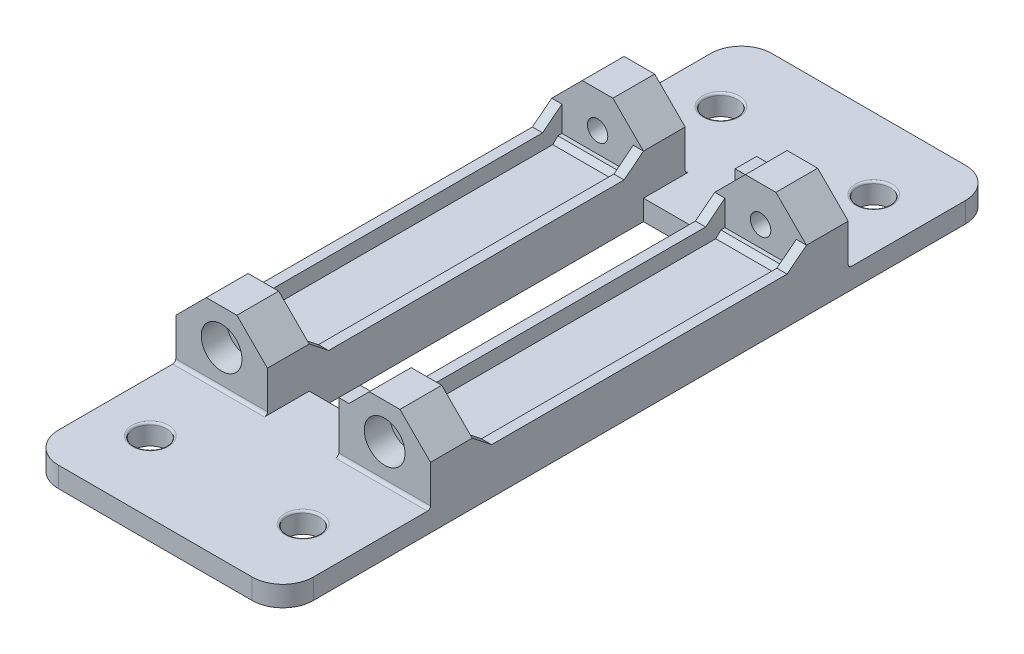
from build123d import *

# Parameters (mm, degrees)
SKETCH1_R                = 1.5
SKETCH1_R_2              = 1
SKETCH1_W                = 6
SKETCH1_H                = 10
EXTRUDE1_DEPTH           = 3
EXTRUDE2_DEPTH           = 4
EXTRUDE3_DEPTH           = 4
SKETCH7_W                = 1
SKETCH7_H                = 38
SKETCH7_W_2              = 6
SKETCH7_H_2              = 10
EXTRUDE4_DEPTH           = 4.5
EXTRUDE5_DEPTH           = 6
SKETCH9_R                = 5.5
SKETCH9_R_2              = 1.5
EXTRUDE10_DEPTH          = 3.5
EXTRUDE11_DEPTH          = 6
EXTRUDE12_DEPTH          = 4
CUT_EXTRUDE1_DEPTH       = 4
CUT_EXTRUDE2_DEPTH       = 4
SKETCH16_R               = 1
EXTRUDE13_DEPTH          = 2.6
CUT_EXTRUDE4_DEPTH       = 3
CUT_EXTRUDE5_DEPTH       = 32.906112267
CUT_EXTRUDE6_DEPTH       = 2
EXTRUDE14_DEPTH          = 25
EXTRUDE15_DEPTH          = 1
EXTRUDE17_DEPTH          = 1
EXTRUDE18_DEPTH          = 1
EXTRUDE19_DEPTH          = 1
CUT_EXTRUDE7_DEPTH       = 43.121847063
SKETCH26_R               = 2
CUT_EXTRUDE8_DEPTH       = 1
SKETCH27_R               = 4
CUT_EXTRUDE9_DEPTH       = 1.5
SKETCH28_R               = 4
CUT_EXTRUDE10_DEPTH      = 1
CUT_EXTRUDE11_DEPTH      = 1.5
FILLET4_R                = 0.25
CUT_EXTRUDE12_DEPTH      = 1.5
SKETCH31_W               = 16.002833782
SKETCH31_H               = 38
CUT_EXTRUDE13_DEPTH      = 32.906112267
CUT_EXTRUDE14_DEPTH      = 14.5
CUT_EXTRUDE14_DEPTH_BACK = 14.5
EXTRUDE20_DEPTH          = 15
EXTRUDE20_DEPTH_BACK     = 15
EXTRUDE21_DEPTH          = 1
CUT_EXTRUDE15_DEPTH      = 0.5
SKETCH36_R               = 1
CUT_EXTRUDE16_DEPTH      = 10.5
SKETCH37_W               = 7
SKETCH37_H               = 2.6
CUT_EXTRUDE18_DEPTH      = 25.459149617
SKETCH38_W               = 25
SKETCH38_H               = 70
BOSS_EXTRUDE1_DEPTH      = 2
FILLET5_R                = 3
SKETCH40_W               = 7
SKETCH40_H               = 22
CUT_EXTRUDE20_DEPTH      = 1
SKETCH41_W               = 7
SKETCH41_H               = 20
BOSS_EXTRUDE2_DEPTH      = 1
SKETCH44_W               = 7
SKETCH44_H               = 10.4
CUT_EXTRUDE22_DEPTH      = 38.5
SKETCH45_W               = 7
SKETCH45_H               = 12
CUT_EXTRUDE23_DEPTH      = 38.436613095
SKETCH46_W               = 7
SKETCH46_H               = 0.4
BOSS_EXTRUDE3_DEPTH      = 0.5
SKETCH47_R               = 2
BOSS_EXTRUDE4_DEPTH      = 1.5
FILLET6_R                = 0.3
SKETCH49_R               = 1.6
CUT_EXTRUDE24_DEPTH      = 38.818646195
FILLET7_R                = 0.2


with BuildPart() as part:
    # Sketch1 → Extrude1 (new body)
    with BuildSketch(Plane(origin=(0, 0, 0), x_dir=(1, 0, 0), z_dir=(0, 1, 0))):
        with BuildLine():
            Line((-12.5, -19), (-12.5, -12.75))
            ThreePointArc((-12.5, -12.75), (-13.085786438, -11.335786438), (-14.5, -10.75))
            Line((-14.5, -10.75), (-19, -10.75))
            ThreePointArc((-19, -10.75), (-22.535533906, -9.285533906), (-24, -5.75))
            Line((-24, -5.75), (-24, 5.75))
            ThreePointArc((-24, 5.75), (-22.535533906, 9.285533906), (-19, 10.75))
            Line((-19, 10.75), (-14.5, 10.75))
            ThreePointArc((-14.5, 10.75), (-13.085786438, 11.335786438), (-12.5, 12.75))
            Line((-12.5, 12.75), (-12.5, 19))
            Line((-12.5, 19), (12.5, 19))
            Line((12.5, 19), (12.5, -19))
            Line((12.5, -19), (-12.5, -19))
        make_face()
        with Locations(Location((-14.5, 0, 0), (0, 0, 270))):
            Circle(SKETCH1_R, mode=Mode.SUBTRACT)
        with Locations(Location((0, 8, 0), (0, 0, 270))):
            Circle(SKETCH1_R_2, mode=Mode.SUBTRACT)
        with Locations(Location((8, 0, 0), (0, 0, 270))):
            Circle(SKETCH1_R_2, mode=Mode.SUBTRACT)
        with Locations(Location((0, -8, 0), (0, 0, 270))):
            Circle(SKETCH1_R_2, mode=Mode.SUBTRACT)
        with Locations(Location((-8, 0, 0), (0, 0, 270))):
            Circle(SKETCH1_R_2, mode=Mode.SUBTRACT)
        with Locations(Location((-20.156854249, 5.656854249, 0), (0, 0, 270))):
            Circle(SKETCH1_R_2, mode=Mode.SUBTRACT)
        with Locations(Location((-20.156854249, -5.656854249, 0), (0, 0, 270))):
            Circle(SKETCH1_R_2, mode=Mode.SUBTRACT)
        with Locations(Location((-8.843145751, -5.656854249, 0), (0, 0, 270))):
            Circle(SKETCH1_R_2, mode=Mode.SUBTRACT)
        with Locations(Location((-8.843145751, 5.656854249, 0), (0, 0, 270))):
            Circle(SKETCH1_R_2, mode=Mode.SUBTRACT)
        with Locations(Location((8, 8, 0), (0, 0, 270))):
            Circle(SKETCH1_R_2, mode=Mode.SUBTRACT)
        with Locations(Location((8, -8, 0), (0, 0, 270))):
            Circle(SKETCH1_R_2, mode=Mode.SUBTRACT)
        Rectangle(SKETCH1_W, SKETCH1_H, mode=Mode.SUBTRACT)
    extrude(amount=EXTRUDE1_DEPTH)

    # Sketch2 → Extrude2 (add)
    # profile 1 of 4: a face of its own
    with BuildSketch(Plane(origin=(0, 0, 0), x_dir=(1, 0, 0), z_dir=(0, 1, 0))):
        Polygon((-19.260278777, -2.310789035), (-16.810789035, -4.760278777), (-17.707364507, -8.106343992), (-21.053429722, -9.002919464), (-23.502919464, -6.553429722), (-22.606343992, -3.207364507), align=None)
        Polygon((-19.559663372, -3.426127712), (-17.926258803, -5.058709362), (-18.523413702, -7.289570039), (-20.75397317, -7.887849066), (-22.387377739, -6.255267415), (-21.79022284, -4.024406738), align=None, mode=Mode.SUBTRACT)
    # profile 2 of 4: a face of its own
    with BuildSketch(Plane(origin=(0, 0, 0), x_dir=(1, 0, 0), z_dir=(0, 1, 0))):
        Polygon((-6.393656008, 3.207364507), (-9.739721223, 2.310789035), (-12.189210965, 4.760278777), (-11.292635493, 8.106343992), (-7.946570278, 9.002919464), (-5.497080536, 6.553429722), align=None)
        Polygon((-7.210429961, 4.023413702), (-9.441290638, 3.426258803), (-11.073872288, 5.059663372), (-10.475593262, 7.29022284), (-8.244732585, 7.887377739), (-6.612150934, 6.25397317), align=None, mode=Mode.SUBTRACT)
    # profile 3 of 4: a face of its own
    with BuildSketch(Plane(origin=(0, 0, 0), x_dir=(1, 0, 0), z_dir=(0, 1, 0))):
        Polygon((-16.810789035, 4.760278777), (-19.260278777, 2.310789035), (-22.606343992, 3.207364507), (-23.502919464, 6.553429722), (-21.053429722, 9.002919464), (-17.707364507, 8.106343992), align=None)
        Polygon((-17.926127712, 5.059663372), (-19.558709362, 3.426258803), (-21.789570039, 4.023413702), (-22.387849066, 6.25397317), (-20.755267415, 7.887377739), (-18.524406738, 7.29022284), align=None, mode=Mode.SUBTRACT)
    # profile 4 of 4: a face of its own
    with BuildSketch(Plane(origin=(0, 0, 0), x_dir=(1, 0, 0), z_dir=(0, 1, 0))):
        Polygon((-12.189210965, -4.760278777), (-9.739721223, -2.310789035), (-6.393656008, -3.207364507), (-5.497080536, -6.553429722), (-7.946570278, -9.002919464), (-11.292635493, -8.106343992), align=None)
        Polygon((-11.073872288, -5.059663372), (-9.441290638, -3.426258803), (-7.210429961, -4.023413702), (-6.612150934, -6.25397317), (-8.244732585, -7.887377739), (-10.475593262, -7.29022284), align=None, mode=Mode.SUBTRACT)
    extrude(amount=EXTRUDE2_DEPTH)

    # Sketch5 → Extrude3 (add)
    # profile 1 of 6: a face of its own
    with BuildSketch(Plane(origin=(0, 0, 0), x_dir=(1, 0, 0), z_dir=(0, 1, 0))):
        Polygon((-3.464101615, -8), (-1.732050808, -11), (1.732050808, -11), (3.464101615, -8), (1.732050808, -5), (-1.732050808, -5), align=None)
        Polygon((-2.309401077, -8), (-1.154700538, -10), (1.154700538, -10), (2.309401077, -8), (1.154700538, -6), (-1.154700538, -6), align=None, mode=Mode.SUBTRACT)
    # profile 2 of 6: a face of its own
    with BuildSketch(Plane(origin=(0, 0, 0), x_dir=(1, 0, 0), z_dir=(0, 1, 0))):
        Polygon((-1.732050808, 11), (1.732050808, 11), (3.464101615, 8), (1.732050808, 5), (-1.732050808, 5), (-3.464101615, 8), align=None)
        Polygon((-1.154700538, 10), (1.154700538, 10), (2.309401077, 8), (1.154700538, 6), (-1.154700538, 6), (-2.309401077, 8), align=None, mode=Mode.SUBTRACT)
    # profile 3 of 6: a face of its own
    with BuildSketch(Plane(origin=(0, 0, 0), x_dir=(1, 0, 0), z_dir=(0, 1, 0))):
        Polygon((11.464101615, 8), (9.732050808, 11), (6.267949192, 11), (4.535898385, 8), (6.267949192, 5), (9.732050808, 5), align=None)
        Polygon((10.309401077, 8), (9.154700538, 10), (6.845299462, 10), (5.690598923, 8), (6.845299462, 6), (9.154700538, 6), align=None, mode=Mode.SUBTRACT)
    # profile 4 of 6: a face of its own
    with BuildSketch(Plane(origin=(0, 0, 0), x_dir=(1, 0, 0), z_dir=(0, 1, 0))):
        Polygon((9.732050808, -11), (6.267949192, -11), (4.535898385, -8), (6.267949192, -5), (9.732050808, -5), (11.464101615, -8), align=None)
        Polygon((9.154700538, -10), (6.845299462, -10), (5.690598923, -8), (6.845299462, -6), (9.154700538, -6), (10.309401077, -8), align=None, mode=Mode.SUBTRACT)
    # profile 5 of 6: a face of its own
    with BuildSketch(Plane(origin=(0, 0, 0), x_dir=(1, 0, 0), z_dir=(0, 1, 0))):
        Polygon((9.732050808, -3), (6.267949192, -3), (4.535898385, 0), (6.267949192, 3), (9.732050808, 3), (11.464101615, 0), align=None)
        Polygon((9.154700538, -2), (6.845299462, -2), (5.690598923, 0), (6.845299462, 2), (9.154700538, 2), (10.309401077, 0), align=None, mode=Mode.SUBTRACT)
    # profile 6 of 6: a face of its own
    with BuildSketch(Plane(origin=(0, 0, 0), x_dir=(1, 0, 0), z_dir=(0, 1, 0))):
        Polygon((-11, -1.732050808), (-11, 1.732050808), (-8, 3.464101615), (-5, 1.732050808), (-5, -1.732050808), (-8, -3.464101615), align=None)
        Polygon((-10, -1.154700538), (-10, 1.154700538), (-8, 2.309401077), (-6, 1.154700538), (-6, -1.154700538), (-8, -2.309401077), align=None, mode=Mode.SUBTRACT)
    extrude(amount=EXTRUDE3_DEPTH)

    # Sketch7 → Extrude4 (add)
    # profile 1 of 3: a face of its own
    with BuildSketch(Plane(origin=(0, 0, 0), x_dir=(1, 0, 0), z_dir=(0, 1, 0))):
        with Locations((-12, 0)):
            Rectangle(SKETCH7_W, SKETCH7_H)
    # profile 2 of 3: a face of its own
    with BuildSketch(Plane(origin=(0, 0, 0), x_dir=(1, 0, 0), z_dir=(0, 1, 0))):
        Polygon((-4.5, 19), (-3.5, 19), (-3.5, 6), (3.5, 6), (3.5, 19), (4.5, 19), (4.5, -19), (3.5, -19), (3.5, -6), (-3.5, -6), (-3.5, -19), (-4.5, -19), align=None)
        Rectangle(SKETCH7_W_2, SKETCH7_H_2, mode=Mode.SUBTRACT)
    # profile 3 of 3: a face of its own
    with BuildSketch(Plane(origin=(0, 0, 0), x_dir=(1, 0, 0), z_dir=(0, 1, 0))):
        with Locations((12, 0)):
            Rectangle(SKETCH7_W, SKETCH7_H)
    extrude(amount=EXTRUDE4_DEPTH)

    # Sketch8 → Extrude5 (add)
    with BuildSketch(Plane(origin=(0, 0, 0), x_dir=(1, 0, 0), z_dir=(0, 1, 0))):
        with BuildLine():
            Line((-11.5, -9.748913396), (-11.5, -10.25))
            ThreePointArc((-11.5, -10.25), (-11.646446609, -10.603553391), (-12, -10.75))
            Line((-12, -10.75), (-19, -10.75))
            ThreePointArc((-19, -10.75), (-22.535533906, -9.285533906), (-24, -5.75))
            Line((-24, -5.75), (-24, 5.751086604))
            ThreePointArc((-24, 5.751086604), (-22.535533906, 9.28662051), (-19, 10.751086604))
            Line((-19, 10.751086604), (-12, 10.751086604))
            ThreePointArc((-12, 10.751086604), (-11.646446609, 10.604639995), (-11.5, 10.251086604))
            Line((-11.5, 10.251086604), (-11.5, 9.751086604))
            ThreePointArc((-11.5, 9.751086604), (-11.646446609, 9.397533214), (-12, 9.251086604))
            Line((-12, 9.251086604), (-19, 9.251086604))
            ThreePointArc((-19, 9.251086604), (-21.474873734, 8.225960339), (-22.5, 5.751086604))
            Line((-22.5, 5.751086604), (-22.5, -5.748913396))
            ThreePointArc((-22.5, -5.748913396), (-21.474873734, -8.22378713), (-19, -9.248913396))
            Line((-19, -9.248913396), (-12, -9.248913396))
            ThreePointArc((-12, -9.248913396), (-11.646446609, -9.395360005), (-11.5, -9.748913396))
        make_face()
    extrude(amount=EXTRUDE5_DEPTH)

    # Sketch9 → Extrude10 (add)
    with BuildSketch(Plane(origin=(0, 0, 0), x_dir=(1, 0, 0), z_dir=(0, 1, 0))):
        with Locations((-14.5, 0)):
            Circle(SKETCH9_R)
        with Locations(Location((-14.5, 0, 0), (0, 0, 270))):
            Circle(SKETCH9_R_2, mode=Mode.SUBTRACT)
    extrude(amount=EXTRUDE10_DEPTH)

    # Sketch10 → Extrude11 (add)
    with BuildSketch(Plane(origin=(0, 0, 0), x_dir=(1, 0, 0), z_dir=(0, 1, 0))):
        Polygon((-16.953738644, 4.25), (-12.046261356, 4.25), (-9.592522712, 0), (-12.046261356, -4.25), (-16.953738644, -4.25), (-19.407477288, 0), align=None)
        Polygon((-16.232050808, 3), (-12.767949192, 3), (-11.035898385, 0), (-12.767949192, -3), (-16.232050808, -3), (-17.964101615, 0), align=None, mode=Mode.SUBTRACT)
    extrude(amount=EXTRUDE11_DEPTH)

    # Sketch12 → Extrude12 (add)
    with BuildSketch(Plane(origin=(0, 0, 0), x_dir=(1, 0, 0), z_dir=(0, 1, 0))):
        with BuildLine():
            Line((-11.5, 4.609772229), (-11.5, -4.609772229))
            ThreePointArc((-11.5, -4.609772229), (-9, 0), (-11.5, 4.609772229))
        make_face()
    extrude(amount=EXTRUDE12_DEPTH)

    # Sketch13 → Cut-Extrude1 (cut)
    with BuildSketch(Plane(origin=(0, 3.5, 0), x_dir=(-1, 0, 0), z_dir=(0, 1, 0))):
        Polygon((11.035898385, 0), (12.767949192, 3), (16.232050808, 3), (17.964101615, 0), (16.232050808, -3), (12.767949192, -3), align=None)
    extrude(amount=CUT_EXTRUDE1_DEPTH, mode=Mode.SUBTRACT)

    # Sketch14 → Cut-Extrude2 (cut)
    with BuildSketch(Plane(origin=(0, 3, 0), x_dir=(-1, 0, 0), z_dir=(0, 1, 0))):
        Polygon((8, -2.309401077), (10, -1.154700538), (10, 1.154700538), (8, 2.309401077), align=None)
    extrude(amount=CUT_EXTRUDE2_DEPTH, mode=Mode.SUBTRACT)

    # Sketch16 → Extrude13 (add)
    # profile 1 of 2: a face of its own
    with BuildSketch(Plane.XY.offset(19)):
        Polygon((12.5, 0), (12.5, 6), (9.5, 9), (6.5, 9), (4.5, 7), (0.5, 7), (-2.5, 6), (-2.5, 3), (0.5, 2), (3.5, 2), (3.5, 0), align=None)
        with Locations((8, 5.5)):
            Circle(SKETCH16_R, mode=Mode.SUBTRACT)
    # profile 2 of 2: a face of its own
    with BuildSketch(Plane.XY.offset(19)):
        Polygon((-6.5, 9), (-3.5, 6), (-3.5, 0), (-12.5, 0), (-12.5, 6), (-9.5, 9), align=None)
        with Locations((-8, 5.5)):
            Circle(SKETCH16_R, mode=Mode.SUBTRACT)
    extrude13 = extrude(amount=-EXTRUDE13_DEPTH)

    # Sketch17 → Cut-Extrude4 (cut)
    with BuildSketch(Plane.XY.offset(19)):
        Polygon((-2.5, 3), (0.5, 2), (4.5, 2), (4.5, 0), (-3.5, 0), (-3.5, 3), align=None)
    cut_extrude4 = extrude(amount=-CUT_EXTRUDE4_DEPTH, mode=Mode.SUBTRACT)

    # Sketch18 → Cut-Extrude5 (cut, through all)
    with BuildSketch(Plane(origin=(0, 0, 0), x_dir=(1, 0, 0), z_dir=(0, 1, 0))):
        with BuildLine():
            Line((-2.5, -16.4), (3.5, -16.4))
            Line((3.5, -16.4), (3.5, -18))
            Line((3.5, -18), (-1.5, -18))
            ThreePointArc((-1.5, -18), (-2, -17.5), (-2.5, -18))
            Line((-2.5, -18), (-2.5, -16.4))
        make_face()
    cut_extrude5 = extrude(amount=CUT_EXTRUDE5_DEPTH, mode=Mode.SUBTRACT)

    # Sketch19 → Cut-Extrude6 (cut)
    with BuildSketch(Plane(origin=(0, 0, 16.4), x_dir=(-1, 0, 0), z_dir=(0, 0, -1))):
        Polygon((-4.5, 7), (-3.5, 6), (-3.5, 7), align=None)
    cut_extrude6 = extrude(amount=-CUT_EXTRUDE6_DEPTH, mode=Mode.SUBTRACT)

    # Sketch20 → Extrude14 (add)
    with BuildSketch(Plane(origin=(12.5, 0, 0), x_dir=(0, 0, -1), z_dir=(1, 0, 0))):
        Polygon((-16, 3), (-15.5, 3), (-16, 3.5), align=None)
    extrude14 = extrude(amount=-EXTRUDE14_DEPTH)

    # Sketch21 → Extrude15 (add)
    with BuildSketch(Plane(origin=(12.5, 0, 0), x_dir=(0, 0, -1), z_dir=(1, 0, 0))):
        Polygon((-16.4, 6), (-14.5, 4.5), (-16.4, 4.5), align=None)
    extrude15 = extrude(amount=-EXTRUDE15_DEPTH)

    # Sketch22 → Extrude17 (add)
    with BuildSketch(Plane(origin=(4.5, 0, 0), x_dir=(0, 0, -1), z_dir=(1, 0, 0))):
        Polygon((-16.4, 6), (-14.5, 4.5), (-16.4, 4.5), align=None)
    extrude17 = extrude(amount=-EXTRUDE17_DEPTH)

    # Sketch23 → Extrude18 (add)
    with BuildSketch(Plane(origin=(-3.5, 0, 0), x_dir=(0, 0, -1), z_dir=(1, 0, 0))):
        Polygon((-16.4, 6), (-14.5, 4.5), (-16.4, 4.5), align=None)
    extrude18 = extrude(amount=-EXTRUDE18_DEPTH)

    # Sketch24 → Extrude19 (add)
    with BuildSketch(Plane(origin=(-11.5, 0, 0), x_dir=(0, 0, -1), z_dir=(1, 0, 0))):
        Polygon((-16.4, 6), (-14.5, 4.5), (-16.4, 4.5), align=None)
    extrude19 = extrude(amount=-EXTRUDE19_DEPTH)

    # Sketch25 → Cut-Extrude7 (cut, through all)
    with BuildSketch(Plane(origin=(12.5, 0, 0), x_dir=(0, 0, -1), z_dir=(1, 0, 0))):
        Polygon((-19, 0), (-17, 0), (-19, 2), align=None)
    cut_extrude7 = extrude(amount=-CUT_EXTRUDE7_DEPTH, mode=Mode.SUBTRACT)

    # Sketch26 → Cut-Extrude8 (cut)
    with BuildSketch(Plane.XY.offset(19)):
        with Locations((-8, 5.5)):
            Circle(SKETCH26_R)
        with Locations((8, 5.5)):
            Circle(SKETCH26_R)
    cut_extrude8 = extrude(amount=-CUT_EXTRUDE8_DEPTH, mode=Mode.SUBTRACT)

    # Mirror1: Extrude13, Cut-Extrude4, Cut-Extrude5, Cut-Extrude6, Extrude14, Extrude15, Extrude17, Extrude18, Extrude19, Cut-Extrude7, Cut-Extrude8 across plane
    add(extrude13.mirror(Plane.XY))
    add(cut_extrude4.mirror(Plane.XY), mode=Mode.SUBTRACT)
    add(cut_extrude5.mirror(Plane.XY), mode=Mode.SUBTRACT)
    add(cut_extrude6.mirror(Plane.XY), mode=Mode.SUBTRACT)
    add(extrude14.mirror(Plane.XY))
    add(extrude15.mirror(Plane.XY))
    add(extrude17.mirror(Plane.XY))
    add(extrude18.mirror(Plane.XY))
    add(extrude19.mirror(Plane.XY))
    add(cut_extrude7.mirror(Plane.XY), mode=Mode.SUBTRACT)
    add(cut_extrude8.mirror(Plane.XY), mode=Mode.SUBTRACT)

    # Sketch27 → Cut-Extrude9 (cut)
    with BuildSketch(Plane.XZ):
        Circle(SKETCH27_R)
    extrude(amount=-CUT_EXTRUDE9_DEPTH, mode=Mode.SUBTRACT)

    # Sketch28 → Cut-Extrude10 (cut)
    with BuildSketch(Plane.XZ):
        with Locations(Location((-14.5, 0, 0), (0, 0, 270))):
            Circle(SKETCH28_R)
    extrude(amount=-CUT_EXTRUDE10_DEPTH, mode=Mode.SUBTRACT)

    # Sketch29 → Cut-Extrude11 (cut)
    with BuildSketch(Plane.ZY.offset(24)):
        with BuildLine():
            Line((-2.500543302, 6), (2.499456698, 6))
            ThreePointArc((2.499456698, 6), (1.91367026, 4.585786438), (0.499456698, 4))
            Line((0.499456698, 4), (-0.500543302, 4))
            ThreePointArc((-0.500543302, 4), (-1.914756865, 4.585786438), (-2.500543302, 6))
        make_face()
    extrude(amount=-CUT_EXTRUDE11_DEPTH, mode=Mode.SUBTRACT)

    # Fillet4
    fillet4_edges = [part.edges().sort_by_distance(p)[0] for p in [
        (-11.023130678, 6, -2.477885683),
        (-10, 6, 0),
        (-14.5, 6, -4.25),
        (-18.180607966, 6, -2.125),
        (-18.180607966, 6, 2.125),
        (-14.5, 6, 4.25),
        (-11.023130678, 6, 2.477885683),
        (-17.098076211, 6, -1.5),
        (-17.098076211, 6, 1.5),
        (-14.5, 6, 3),
        (-11.901923789, 6, 1.5),
        (-11.901923789, 6, -1.5),
        (-14.5, 6, -3),
    ]]
    fillet(fillet4_edges, radius=FILLET4_R)

    # Sketch30 → Cut-Extrude12 (cut)
    with BuildSketch(Plane(origin=(0, 3.5, 0), x_dir=(-1, 0, 0), z_dir=(0, 1, 0))):
        Polygon((16.232050808, -3), (12.767949192, -3), (11.035898385, 0), (12.767949192, 3), (16.232050808, 3), (17.964101615, 0), align=None)
    extrude(amount=-CUT_EXTRUDE12_DEPTH, mode=Mode.SUBTRACT)

    # Sketch31 → Cut-Extrude13 (cut, through all)
    with BuildSketch(Plane.XZ):
        with Locations((-20.501416891, 0)):
            Rectangle(SKETCH31_W, SKETCH31_H)
    extrude(amount=-CUT_EXTRUDE13_DEPTH, mode=Mode.SUBTRACT)

    # Sketch32 → Cut-Extrude14 (cut, two sides: drawn at the far end of the back side and taken through both)
    with BuildSketch(Plane(origin=(0, 0, 0), x_dir=(-1, 0, 0), z_dir=(0, 0, -1)).offset(-CUT_EXTRUDE14_DEPTH_BACK)):
        Polygon((12.837931972, 9.642365277), (4.5, 4.5), (4.5, 3), (11.5, 3), (11.5, 4.5), (12.837931972, 4.5), align=None)
    extrude(amount=CUT_EXTRUDE14_DEPTH + CUT_EXTRUDE14_DEPTH_BACK, mode=Mode.SUBTRACT)

    # Sketch33 → Extrude20 (add, two sides: drawn at the far end of the back side and taken through both)
    with BuildSketch(Plane.XY.offset(-EXTRUDE20_DEPTH_BACK)):
        Polygon((-4.5, 0), (-12.5, 0), (-12.5, 4.5), (-11.5, 4.5), (-11.5, 3), (-4.5, 3), align=None)
    extrude(amount=EXTRUDE20_DEPTH + EXTRUDE20_DEPTH_BACK)

    # Sketch34 → Extrude21 (add)
    # profile 1 of 3: a face of its own
    with BuildSketch(Plane(origin=(0, 3, 0), x_dir=(-1, 0, 0), z_dir=(0, 1, 0))):
        Polygon((6.267949192, 5), (4.535898385, 8), (6.267949192, 11), (9.732050808, 11), (11.464101615, 8), (9.732050808, 5), align=None)
        Polygon((6.845299462, 6), (5.690598923, 8), (6.845299462, 10), (9.154700538, 10), (10.309401077, 8), (9.154700538, 6), align=None, mode=Mode.SUBTRACT)
    # profile 2 of 3: a face of its own
    with BuildSketch(Plane(origin=(0, 3, 0), x_dir=(-1, 0, 0), z_dir=(0, 1, 0))):
        Polygon((6.267949192, -3), (4.535898385, 0), (6.267949192, 3), (9.732050808, 3), (11.464101615, 0), (9.732050808, -3), align=None)
        Polygon((6.845299462, -2), (5.690598923, 0), (6.845299462, 2), (9.154700538, 2), (10.309401077, 0), (9.154700538, -2), align=None, mode=Mode.SUBTRACT)
    # profile 3 of 3: a face of its own
    with BuildSketch(Plane(origin=(0, 3, 0), x_dir=(-1, 0, 0), z_dir=(0, 1, 0))):
        Polygon((6.267949192, -11), (4.535898385, -8), (6.267949192, -5), (9.732050808, -5), (11.464101615, -8), (9.732050808, -11), align=None)
        Polygon((6.845299462, -10), (5.690598923, -8), (6.845299462, -6), (9.154700538, -6), (10.309401077, -8), (9.154700538, -10), align=None, mode=Mode.SUBTRACT)
    extrude(amount=EXTRUDE21_DEPTH)

    # Sketch35 → Cut-Extrude15 (cut)
    with BuildSketch(Plane(origin=(0, 3, 0), x_dir=(-1, 0, 0), z_dir=(0, 1, 0))):
        Polygon((10.309401077, -8), (9.154700538, -6), (6.845299462, -6), (5.690598923, -8), (6.845299462, -10), (9.154700538, -10), align=None)
        Polygon((10.309401077, 0), (9.154700538, 2), (6.845299462, 2), (5.690598923, 0), (6.845299462, -2), (9.154700538, -2), align=None)
        Polygon((-2.309401077, -8), (-1.154700538, -6), (1.154700538, -6), (2.309401077, -8), (1.154700538, -10), (-1.154700538, -10), align=None)
        Polygon((10.309401077, 8), (9.154700538, 10), (6.845299462, 10), (5.690598923, 8), (6.845299462, 6), (9.154700538, 6), align=None)
        Polygon((-1.154700538, 6), (1.154700538, 6), (2.309401077, 8), (1.154700538, 10), (-1.154700538, 10), (-2.309401077, 8), align=None)
        Polygon((-5.690598923, 0), (-6.845299462, -2), (-9.154700538, -2), (-10.309401077, 0), (-9.154700538, 2), (-6.845299462, 2), align=None)
        Polygon((-9.154700538, 6), (-10.309401077, 8), (-9.154700538, 10), (-6.845299462, 10), (-5.690598923, 8), (-6.845299462, 6), align=None)
        Polygon((-9.154700538, -10), (-10.309401077, -8), (-9.154700538, -6), (-6.845299462, -6), (-5.690598923, -8), (-6.845299462, -10), align=None)
    extrude(amount=-CUT_EXTRUDE15_DEPTH, mode=Mode.SUBTRACT)

    # Sketch36 → Cut-Extrude16 (cut)
    with BuildSketch(Plane.XZ):
        with Locations(Location((-8, 8, 0), (0, 0, 270))):
            Circle(SKETCH36_R)
        with Locations(Location((-8, 0, 0), (0, 0, 270))):
            Circle(SKETCH36_R)
        with Locations(Location((-8, -8, 0), (0, 0, 270))):
            Circle(SKETCH36_R)
    extrude(amount=-CUT_EXTRUDE16_DEPTH, mode=Mode.SUBTRACT)

    # Sketch37 → Cut-Extrude18 (cut, through all)
    with BuildSketch(Plane(origin=(0, 0, 0), x_dir=(1, 0, 0), z_dir=(0, 1, 0))):
        with Locations((0, 17.7)):
            Rectangle(SKETCH37_W, SKETCH37_H)
        with Locations((0, -17.7)):
            Rectangle(SKETCH37_W, SKETCH37_H)
    extrude(amount=CUT_EXTRUDE18_DEPTH, mode=Mode.SUBTRACT)

    # Sketch38 → Boss-Extrude1 (add)
    with BuildSketch(Plane(origin=(0, 0, 0), x_dir=(1, 0, 0), z_dir=(0, 1, 0))):
        Rectangle(SKETCH38_W, SKETCH38_H)
    extrude(amount=BOSS_EXTRUDE1_DEPTH)

    # Fillet5
    fillet5_edges = [part.edges().sort_by_distance(p)[0] for p in [
        (12.5, 1, 35),
        (-12.5, 1, -35),
        (-12.5, 1, 35),
        (12.5, 1, -35),
    ]]
    fillet(fillet5_edges, radius=FILLET5_R)

    # Sketch40 → Cut-Extrude20 (cut)
    with BuildSketch(Plane(origin=(0, 4, 0), x_dir=(1, 0, 0), z_dir=(0, 1, 0))):
        with Locations((8, 0)):
            Rectangle(SKETCH40_W, SKETCH40_H)
        with Locations((-8, 0)):
            Rectangle(SKETCH40_W, SKETCH40_H)
    extrude(amount=-CUT_EXTRUDE20_DEPTH, mode=Mode.SUBTRACT)

    # Sketch41 → Boss-Extrude2 (add)
    with BuildSketch(Plane(origin=(0, 2, 0), x_dir=(1, 0, 0), z_dir=(0, 1, 0))):
        with Locations((8, 0)):
            Rectangle(SKETCH41_W, SKETCH41_H)
        with Locations((-8, 0)):
            Rectangle(SKETCH41_W, SKETCH41_H)
    extrude(amount=BOSS_EXTRUDE2_DEPTH)

    # Sketch44 → Cut-Extrude22 (cut, through all)
    with BuildSketch(Plane(origin=(0, 4, 0), x_dir=(1, 0, 0), z_dir=(0, 1, 0))):
        with Locations((0, 11.2)):
            Rectangle(SKETCH44_W, SKETCH44_H)
        with Locations((0, -11.2)):
            Rectangle(SKETCH44_W, SKETCH44_H)
    extrude(amount=-CUT_EXTRUDE22_DEPTH, mode=Mode.SUBTRACT)

    # Sketch45 → Cut-Extrude23 (cut, through all)
    with BuildSketch(Plane(origin=(0, 4.5, 0), x_dir=(1, 0, 0), z_dir=(0, 1, 0))):
        Rectangle(SKETCH45_W, SKETCH45_H)
    extrude(amount=-CUT_EXTRUDE23_DEPTH, mode=Mode.SUBTRACT)

    # Sketch46 → Boss-Extrude3 (add)
    with BuildSketch(Plane(origin=(0, 3, 0), x_dir=(1, 0, 0), z_dir=(0, 1, 0))):
        with Locations((-8, 16.2)):
            Rectangle(SKETCH46_W, SKETCH46_H)
        with Locations((8, 16.2)):
            Rectangle(SKETCH46_W, SKETCH46_H)
        with Locations((8, -16.2)):
            Rectangle(SKETCH46_W, SKETCH46_H)
        with Locations((-8, -16.2)):
            Rectangle(SKETCH46_W, SKETCH46_H)
    extrude(amount=BOSS_EXTRUDE3_DEPTH)

    # Sketch47 → Boss-Extrude4 (add)
    # profile 1 of 2: a face of its own
    with BuildSketch(Plane.XY.offset(19)):
        Polygon((-9.5, 9), (-6.5, 9), (-3.5, 6), (-3.5, 2), (-12.5, 2), (-12.5, 6), align=None)
        with Locations((-8, 5.5)):
            Circle(SKETCH47_R, mode=Mode.SUBTRACT)
    # profile 2 of 2: a face of its own
    with BuildSketch(Plane.XY.offset(19)):
        Polygon((3.5, 7), (4.5, 7), (6.5, 9), (9.5, 9), (12.5, 6), (12.5, 2), (3.5, 2), align=None)
        with Locations((8, 5.5)):
            Circle(SKETCH47_R, mode=Mode.SUBTRACT)
    boss_extrude4 = extrude(amount=BOSS_EXTRUDE4_DEPTH)

    # Mirror2: Boss-Extrude4 across plane
    add(boss_extrude4.mirror(Plane.XY))

    # Fillet6
    fillet6_edges = [part.edges().sort_by_distance(p)[0] for p in [
        (-8, 2, 20.5),
        (8, 2, 20.5),
        (-8, 2, -20.5),
        (8, 2, -20.5),
    ]]
    fillet(fillet6_edges, radius=FILLET6_R)

    # Sketch49 → Cut-Extrude24 (cut, through all)
    with BuildSketch(Plane(origin=(0, 2, 0), x_dir=(1, 0, 0), z_dir=(0, 1, 0))):
        with Locations(Location((7.5, 28, 0), (0, 0, 270))):
            Circle(SKETCH49_R)
        with Locations(Location((-7.5, 28, 0), (0, 0, 270))):
            Circle(SKETCH49_R)
        with Locations(Location((-7.5, -28, 0), (0, 0, 90))):
            Circle(SKETCH49_R)
        with Locations(Location((7.5, -28, 0), (0, 0, 270))):
            Circle(SKETCH49_R)
    extrude(amount=-CUT_EXTRUDE24_DEPTH, mode=Mode.SUBTRACT)

    # Fillet7
    fillet7_edges = [part.edges().sort_by_distance(p)[0] for p in [
        (7.5, 2, -29.6),
        (-7.5, 2, -29.6),
        (-7.5, 2, 29.6),
        (7.5, 2, 26.4),
    ]]
    fillet(fillet7_edges, radius=FILLET7_R)


solid = part.part
